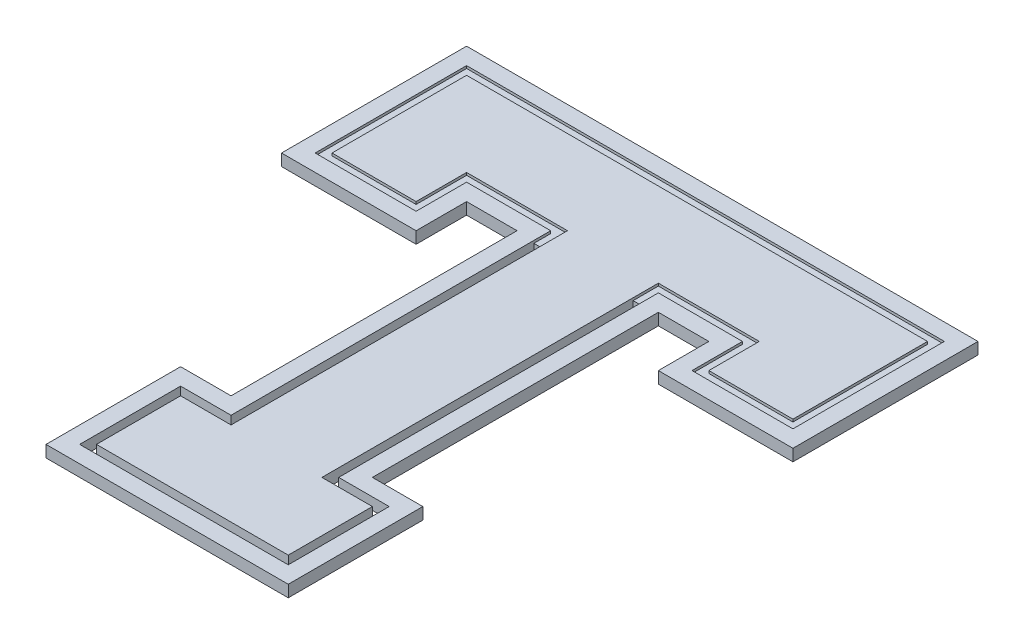
from build123d import *

# Parameters (mm, degrees)
BOSS_EXTRUDE1_DEPTH = 1.778
CUT_EXTRUDE1_DEPTH  = 0.381


with BuildPart() as part:
    # Sketch1 → Boss-Extrude1 (new body)
    with BuildSketch(Plane(origin=(0, 0, 0), x_dir=(1, 0, 0), z_dir=(0, 1, 0))):
        Polygon((-20.32, 83.82), (-20.32, 55.88), (0, 55.88), (0, 63.5), (7.62, 63.5), (7.62, 20.32), (0, 20.32), (0, 0), (36.576, 0), (36.576, 20.32), (28.956, 20.32), (28.956, 63.5), (36.576, 63.5), (36.576, 55.88), (56.896, 55.88), (56.896, 83.82), align=None)
        Polygon((10.16, 17.78), (2.54, 17.78), (2.54, 2.54), (34.036, 2.54), (34.036, 17.78), (26.416, 17.78), (26.416, 63.5), (25.146, 63.5), (25.146, 16.51), (32.766, 16.51), (32.766, 3.81), (3.81, 3.81), (3.81, 16.51), (11.43, 16.51), (11.43, 63.5), (10.16, 63.5), align=None, mode=Mode.SUBTRACT)
    extrude(amount=BOSS_EXTRUDE1_DEPTH)

    # Sketch2 → Cut-Extrude1 (cut)
    with BuildSketch(Plane(origin=(0, 1.778, 0), x_dir=(1, 0, 0), z_dir=(0, 1, 0))):
        Polygon((-16.51, 80.01), (53.086, 80.01), (53.086, 59.69), (40.386, 59.69), (40.386, 67.31), (25.146, 67.31), (25.146, 63.5), (26.416, 63.5), (26.416, 66.04), (39.116, 66.04), (39.116, 58.42), (54.356, 58.42), (54.356, 81.28), (-17.78, 81.28), (-17.78, 58.42), (-2.54, 58.42), (-2.54, 66.04), (10.16, 66.04), (10.16, 63.5), (11.43, 63.5), (11.43, 67.31), (-3.81, 67.31), (-3.81, 59.69), (-16.51, 59.69), align=None)
    extrude(amount=-CUT_EXTRUDE1_DEPTH, mode=Mode.SUBTRACT)


solid = part.part
